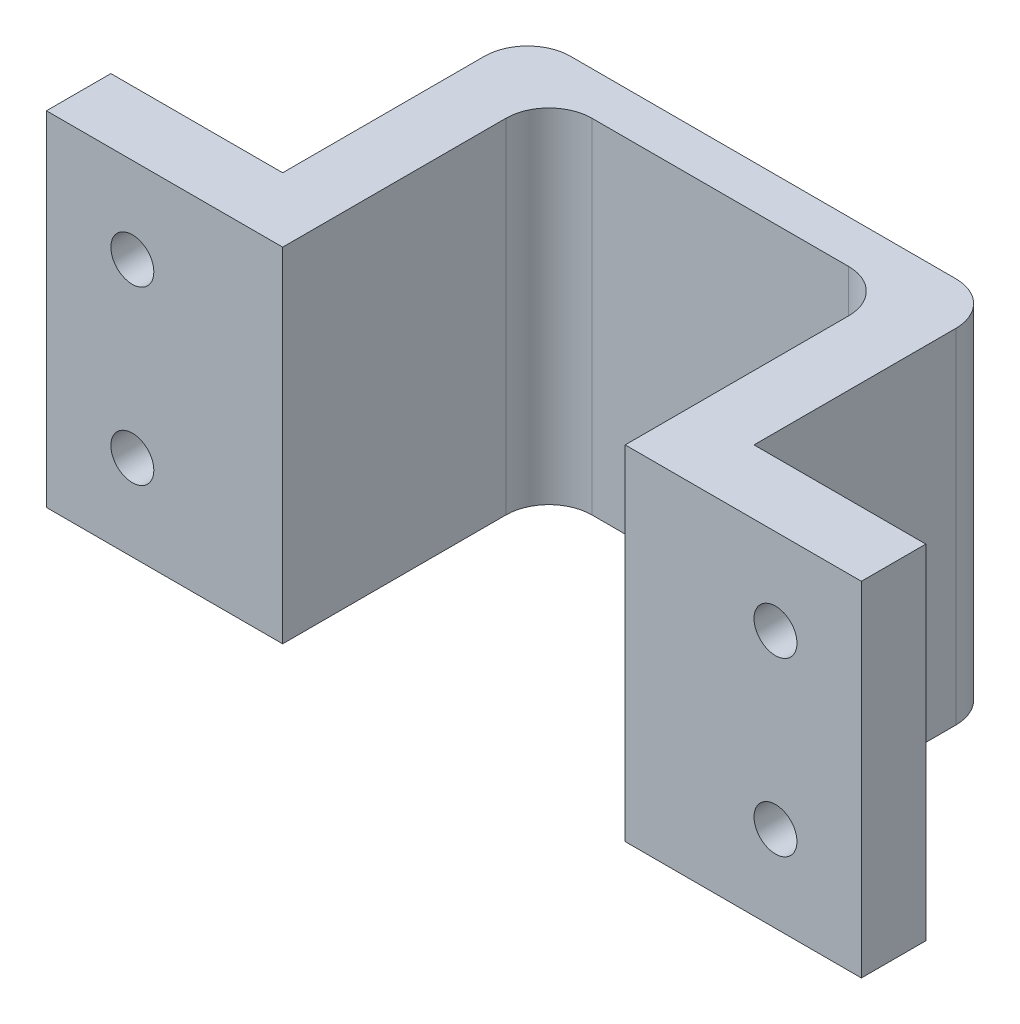
from build123d import *

# Parameters (mm, degrees)
SKETCH1_W           = 21.95
SKETCH1_H           = 16
BOSS_EXTRUDE1_DEPTH = 2
SKETCH2_W           = 3
SKETCH2_H           = 16
BOSS_EXTRUDE2_DEPTH = 12.4
SKETCH3_W           = 3
SKETCH3_H           = 16
BOSS_EXTRUDE3_DEPTH = 8
SKETCH4_W           = 3
SKETCH4_H           = 16
BOSS_EXTRUDE4_DEPTH = 8
SKETCH5_R           = 1
CUT_EXTRUDE1_DEPTH  = 8
FILLET1_R           = 2
FILLET2_R           = 2


with BuildPart() as part:
    # Sketch1 → Boss-Extrude1 (new body)
    with BuildSketch(Plane.XY):
        with Locations((10.975, 8)):
            Rectangle(SKETCH1_W, SKETCH1_H)
    extrude(amount=BOSS_EXTRUDE1_DEPTH)

    # Sketch2 → Boss-Extrude2 (add)
    with BuildSketch(Plane.XY.offset(2)):
        with Locations((1.5, 8)):
            Rectangle(SKETCH2_W, SKETCH2_H)
        with Locations((20.45, 8)):
            Rectangle(SKETCH2_W, SKETCH2_H)
    extrude(amount=BOSS_EXTRUDE2_DEPTH)

    # Sketch3 → Boss-Extrude3 (add)
    with BuildSketch(Plane(origin=(21.95, 0, 0), x_dir=(0, 0, -1), z_dir=(1, 0, 0))):
        with Locations((-12.9, 8)):
            Rectangle(SKETCH3_W, SKETCH3_H)
    extrude(amount=BOSS_EXTRUDE3_DEPTH)

    # Sketch4 → Boss-Extrude4 (add)
    with BuildSketch(Plane.ZY):
        with Locations((12.9, 8)):
            Rectangle(SKETCH4_W, SKETCH4_H)
    extrude(amount=BOSS_EXTRUDE4_DEPTH)

    # Sketch5 → Cut-Extrude1 (cut)
    with BuildSketch(Plane(origin=(0, 0, 11.4), x_dir=(-1, 0, 0), z_dir=(0, 0, -1))):
        with Locations((4, 4)):
            Circle(SKETCH5_R)
        with Locations((-25.95, 4)):
            Circle(SKETCH5_R)
        with Locations((4, 12)):
            Circle(SKETCH5_R)
        with Locations((-25.95, 12)):
            Circle(SKETCH5_R)
    extrude(amount=-CUT_EXTRUDE1_DEPTH, mode=Mode.SUBTRACT)

    # Fillet1
    fillet1_edges = [part.edges().sort_by_distance(p)[0] for p in [
        (3, 8, 2),
        (18.95, 8, 2),
    ]]
    fillet(fillet1_edges, radius=FILLET1_R)

    # Fillet2
    fillet2_edges = [part.edges().sort_by_distance(p)[0] for p in [
        (21.95, 8, 0),
        (0, 8, 0),
    ]]
    fillet(fillet2_edges, radius=FILLET2_R)


solid = part.part
